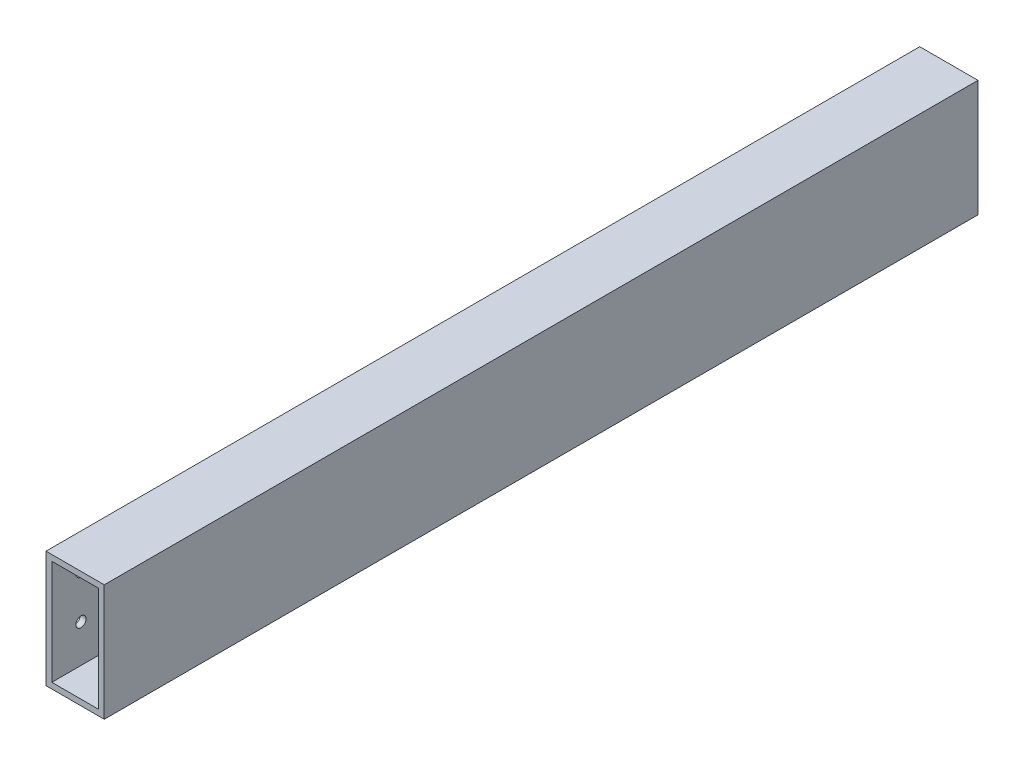
from build123d import *

# Parameters (mm, degrees)
ESBO_O1_W                = 20
ESBO_O1_H                = 40
ESBO_O1_W_2              = 16
ESBO_O1_H_2              = 36
RESSALTO_EXTRUS_O1_DEPTH = 300
ESBO_O2_R                = 1.75
CORTE_EXTRUS_O1_DEPTH    = 2


with BuildPart() as part:
    # Esboço1 → Ressalto-extrusão1 (new body)
    with BuildSketch(Plane.XY):
        with Locations((10, 20)):
            Rectangle(ESBO_O1_W, ESBO_O1_H)
        with Locations((10, 20)):
            Rectangle(ESBO_O1_W_2, ESBO_O1_H_2, mode=Mode.SUBTRACT)
    extrude(amount=RESSALTO_EXTRUS_O1_DEPTH)

    # Esboço2 → Corte-extrusão1 (cut)
    with BuildSketch(Plane.ZY):
        with Locations((10, 30)):
            Circle(ESBO_O2_R)
        with Locations((10, 15)):
            Circle(ESBO_O2_R)
        with Locations((70, 15)):
            Circle(ESBO_O2_R)
        with Locations((55, 15)):
            Circle(ESBO_O2_R)
        with Locations(Location((230, 15, 0), (0, 0, 180))):
            Circle(ESBO_O2_R)
        with Locations(Location((245, 15, 0), (0, 0, 180))):
            Circle(ESBO_O2_R)
        with Locations(Location((290, 15, 0), (0, 0, 180))):
            Circle(ESBO_O2_R)
        with Locations(Location((290, 30, 0), (0, 0, 180))):
            Circle(ESBO_O2_R)
    extrude(amount=-CORTE_EXTRUS_O1_DEPTH, mode=Mode.SUBTRACT)


solid = part.part
